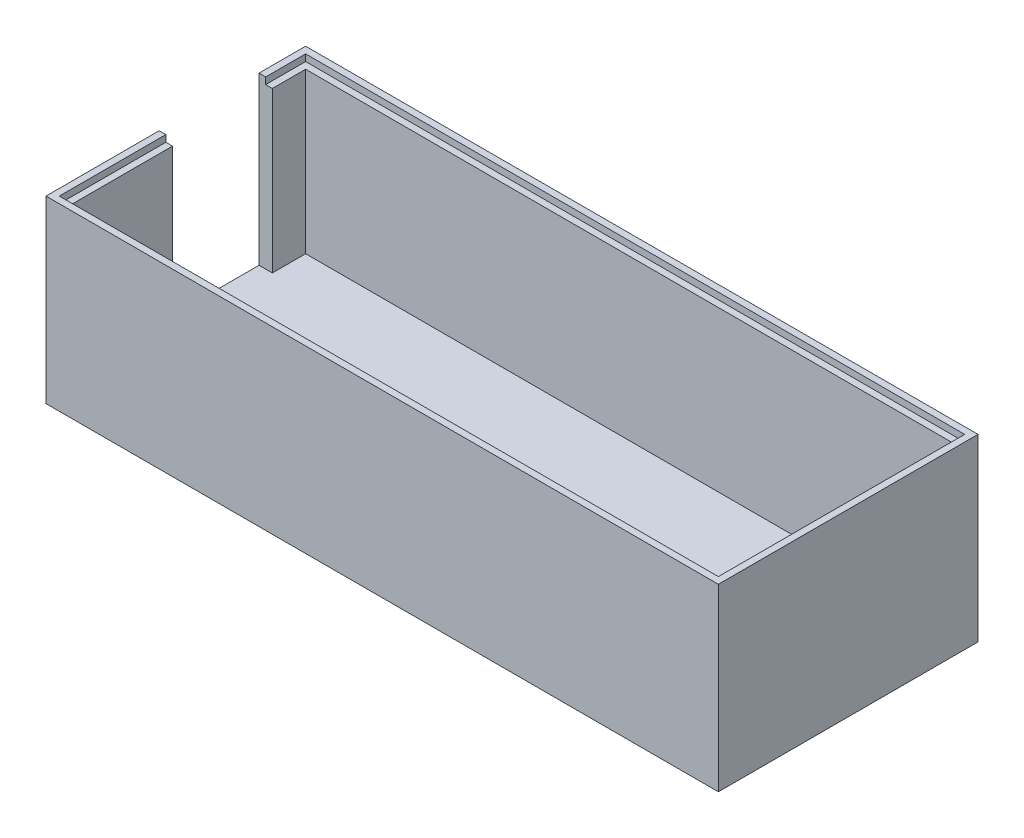
from build123d import *

# Parameters (mm, degrees)
BOSS_EXTRUDE1_DEPTH = 25
SKETCH2_W           = 101
SKETCH2_H           = 39
BOSS_EXTRUDE2_DEPTH = 2
CUT_EXTRUDE1_DEPTH  = 1


with BuildPart() as part:
    # Sketch1 → Boss-Extrude1 (new body)
    with BuildSketch(Plane(origin=(0, 0, 0), x_dir=(1, 0, 0), z_dir=(0, 1, 0))):
        Polygon((0, 39), (0, 32), (2, 32), (2, 37), (99, 37), (99, 2), (2, 2), (2, 17), (0, 17), (0, 0), (101, 0), (101, 39), align=None)
    extrude(amount=BOSS_EXTRUDE1_DEPTH)

    # Sketch2 → Boss-Extrude2 (add)
    with BuildSketch(Plane(origin=(0, 0, 0), x_dir=(-1, 0, 0), z_dir=(0, -1, 0))):
        with Locations((-50.5, 19.5)):
            Rectangle(SKETCH2_W, SKETCH2_H)
    extrude(amount=BOSS_EXTRUDE2_DEPTH)

    # Sketch3 → Cut-Extrude1 (cut)
    with BuildSketch(Plane(origin=(0, 25, 0), x_dir=(1, 0, 0), z_dir=(0, 1, 0))):
        Polygon((2, 32), (1, 32), (1, 38), (100, 38), (100, 1), (1, 1), (1, 17), (2, 17), (2, 2), (99, 2), (99, 37), (2, 37), align=None)
    extrude(amount=-CUT_EXTRUDE1_DEPTH, mode=Mode.SUBTRACT)


solid = part.part
